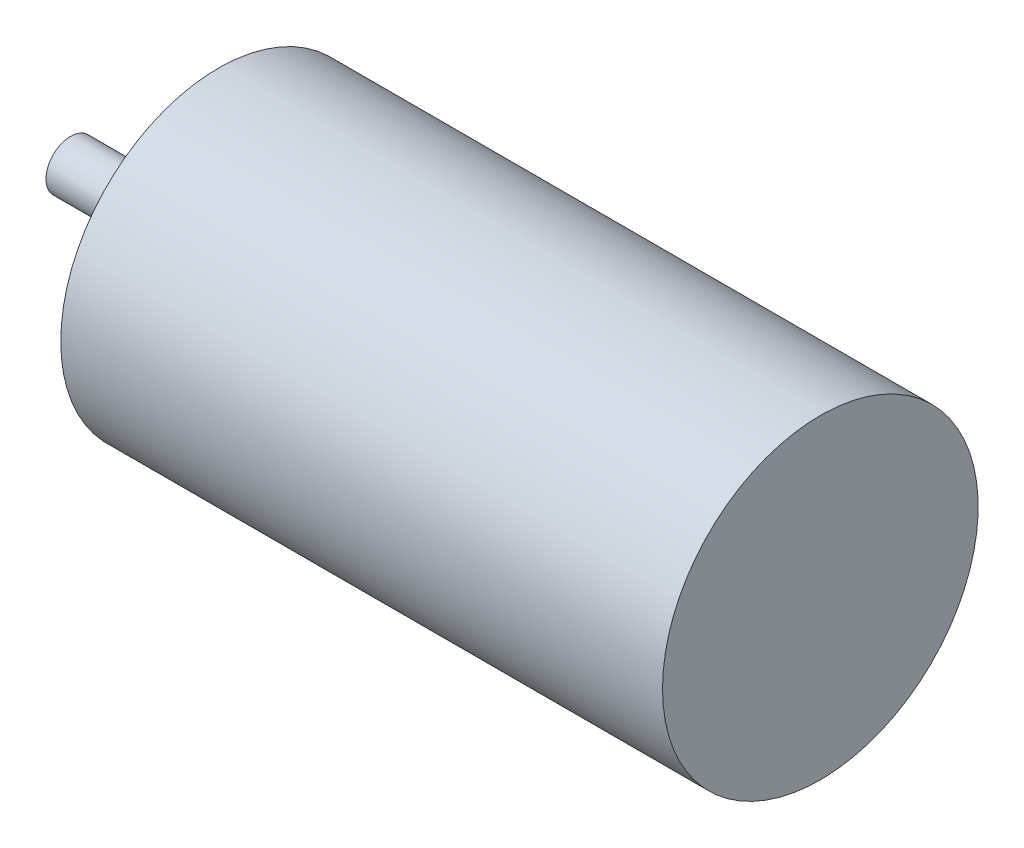
from build123d import *

# Parameters (mm, degrees)
SKETCH1_R           = 16
BOSS_EXTRUDE1_DEPTH = 61
SKETCH2_R           = 11
BOSS_EXTRUDE2_DEPTH = 2
SKETCH3_R           = 1.5
CUT_EXTRUDE1_DEPTH  = 4
SKETCH4_R           = 2.5
BOSS_EXTRUDE3_DEPTH = 13


with BuildPart() as part:
    # Sketch1 → Boss-Extrude1 (new body)
    with BuildSketch(Plane(origin=(0, 0, 0), x_dir=(0, 0, -1), z_dir=(1, 0, 0))):
        with Locations(Location((0, 0, 0), (0, 0, 180))):
            Circle(SKETCH1_R)
    extrude(amount=BOSS_EXTRUDE1_DEPTH)

    # Sketch2 → Boss-Extrude2 (add)
    with BuildSketch(Plane.ZY):
        Circle(SKETCH2_R)
    extrude(amount=BOSS_EXTRUDE2_DEPTH)

    # Sketch3 → Cut-Extrude1 (cut)
    with BuildSketch(Plane.ZY):
        with Locations((0, 13.5)):
            Circle(SKETCH3_R)
        with Locations((11.691342951, 6.75)):
            Circle(SKETCH3_R)
        with Locations((11.691342951, -6.75)):
            Circle(SKETCH3_R)
        with Locations((0, -13.5)):
            Circle(SKETCH3_R)
        with Locations((-11.691342951, -6.75)):
            Circle(SKETCH3_R)
        with Locations((-11.691342951, 6.75)):
            Circle(SKETCH3_R)
    extrude(amount=-CUT_EXTRUDE1_DEPTH, mode=Mode.SUBTRACT)

    # Sketch4 → Boss-Extrude3 (add)
    with BuildSketch(Plane.ZY.offset(2)):
        with Locations(Location((0, 0, 0), (0, 0, 180))):
            Circle(SKETCH4_R)
    extrude(amount=BOSS_EXTRUDE3_DEPTH)


solid = part.part
